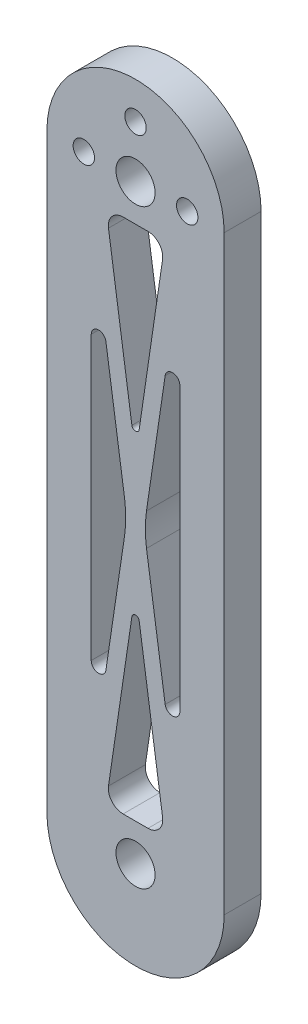
from build123d import *

# Parameters (mm, degrees)
SKETCH_1_R      = 2.65
SKETCH_1_R_2    = 1.45
EXTRUDE_1_DEPTH = 5


with BuildPart() as part:
    # 草图1 → 凸台-拉伸1 (new body)
    with BuildSketch(Plane.XY):
        with BuildLine():
            Line((-12, 40), (-12, -40))
            ThreePointArc((-12, -40), (0, -52), (12, -40))
            Line((12, -40), (12, 40))
            ThreePointArc((12, 40), (0, 52), (-12, 40))
        make_face()
        with Locations((0, 40)):
            Circle(SKETCH_1_R, mode=Mode.SUBTRACT)
        with Locations((0, -40)):
            Circle(SKETCH_1_R, mode=Mode.SUBTRACT)
        with Locations((7, 40)):
            Circle(SKETCH_1_R_2, mode=Mode.SUBTRACT)
        with Locations((-7, 40)):
            Circle(SKETCH_1_R_2, mode=Mode.SUBTRACT)
        with Locations((0, 47)):
            Circle(SKETCH_1_R_2, mode=Mode.SUBTRACT)
        with BuildLine():
            Line((-1.684371732, 35), (1.684371732, 35))
            ThreePointArc((1.684371732, 35), (3.19797273, 34.307291865), (3.663090003, 32.709012019))
            Line((3.663090003, 32.709012019), (0.494679568, 11.16382106))
            ThreePointArc((0.494679568, 11.16382106), (0, 10.736568055), (-0.494679568, 11.16382106))
            Line((-0.494679568, 11.16382106), (-3.663090003, 32.709012019))
            ThreePointArc((-3.663090003, 32.709012019), (-3.19797273, 34.307291865), (-1.684371732, 35))
        make_face(mode=Mode.SUBTRACT)
        with BuildLine():
            Line((6, 19.095781345), (6, -19.163256412))
            ThreePointArc((6, -19.163256412), (5.073630361, -20.160542013), (4.01084286, -19.31011741))
            Line((4.01084286, -19.31011741), (1.482419396, -2.280353461))
            ThreePointArc((1.482419396, -2.280353461), (1.319777526, -0.083000608), (1.480789762, 2.114472259))
            Line((1.480789762, 2.114472259), (4.010734218, 19.241908728))
            ThreePointArc((4.010734218, 19.241908728), (5.073260555, 20.09309418), (6, 19.095781345))
        make_face(mode=Mode.SUBTRACT)
        with BuildLine():
            Line((-1.684371732, -35), (1.684371732, -35))
            ThreePointArc((1.684371732, -35), (3.19839114, -34.306807267), (3.662903296, -32.707745233))
            Line((3.662903296, -32.707745233), (0.494632891, -11.258914622))
            ThreePointArc((0.494632891, -11.258914622), (0, -10.831978314), (-0.494632891, -11.258914622))
            Line((-0.494632891, -11.258914622), (-3.662903296, -32.707745233))
            ThreePointArc((-3.662903296, -32.707745233), (-3.19839114, -34.306807267), (-1.684371732, -35))
        make_face(mode=Mode.SUBTRACT)
        with BuildLine():
            Line((-6, -19.163256412), (-6, 19.095781345))
            ThreePointArc((-6, 19.095781345), (-5.073260555, 20.09309418), (-4.010734218, 19.241908728))
            Line((-4.010734218, 19.241908728), (-1.480789762, 2.114472259))
            ThreePointArc((-1.480789762, 2.114472259), (-1.319777526, -0.083000608), (-1.482419396, -2.280353461))
            Line((-1.482419396, -2.280353461), (-4.01084286, -19.31011741))
            ThreePointArc((-4.01084286, -19.31011741), (-5.073630361, -20.160542013), (-6, -19.163256412))
        make_face(mode=Mode.SUBTRACT)
    extrude(amount=EXTRUDE_1_DEPTH)


solid = part.part
